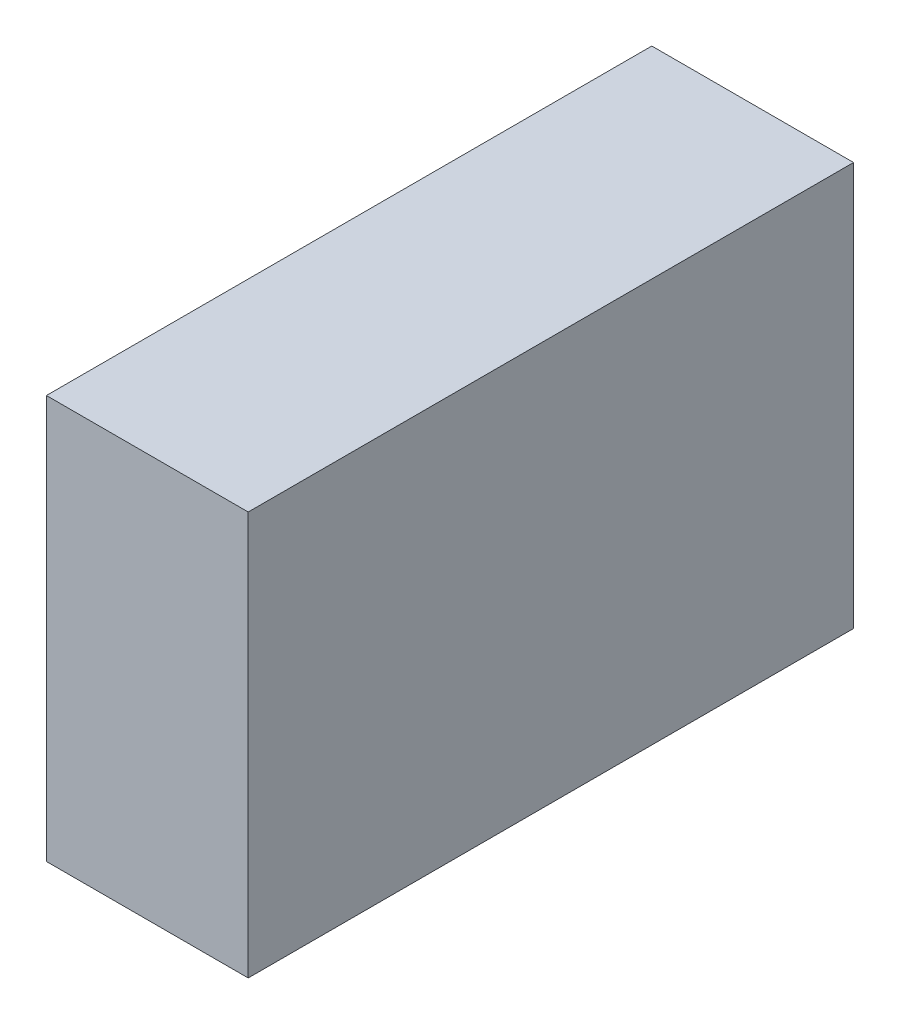
from build123d import *

# Parameters (mm, degrees)
SKETCH2_W           = 50
SKETCH2_H           = 100
BOSS_EXTRUDE1_DEPTH = 150


with BuildPart() as part:
    # Sketch2 → Boss-Extrude1 (new body)
    with BuildSketch(Plane.XY):
        Rectangle(SKETCH2_W, SKETCH2_H)
    extrude(amount=BOSS_EXTRUDE1_DEPTH)


solid = part.part
